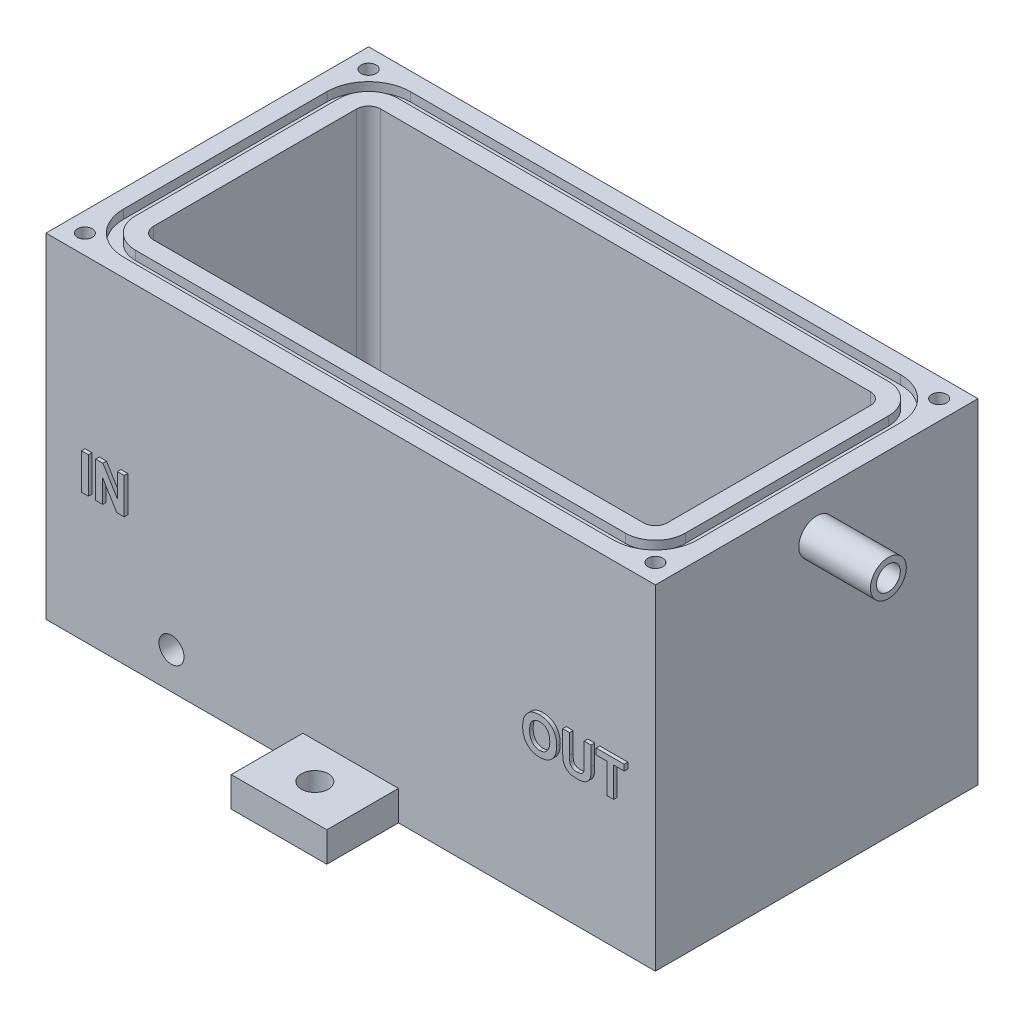
from build123d import *

# Parameters (mm, degrees)
SKETCH1_W                = 102
SKETCH1_H                = 54
BODY_DEPTH               = 56
CHAMBER_START            = 56
CHAMBER_DEPTH            = 52
FLOOR_FILLET_R           = 2
GASKET_GROOVE_START      = 56
GASKET_GROOVE_DEPTH      = 1.5
CAP_SCREW_HOLES_M3_START = 56
SKETCH4_R                = 1.25
CAP_SCREW_HOLES_M3_DEPTH = 12
INLET_BARB_START         = -63
SKETCH5_R                = 3
INLET_BARB_DEPTH         = 12
OUTLET_BARB_START        = 51
SKETCH6_R                = 3
OUTLET_BARB_DEPTH        = 12
INLET_BORE_START         = -63
SKETCH7_R                = 2
INLET_BORE_DEPTH         = 20.5
OUTLET_BORE_START        = 42.5
SKETCH8_R                = 2
OUTLET_BORE_DEPTH        = 20.5
DRAIN_HOLE_M5_START      = 18.5
SKETCH9_R                = 2.1
DRAIN_HOLE_M5_DEPTH      = 9
SKETCH10_W               = 16
SKETCH10_H               = 12
FOOT_FRONT_DEPTH         = 5
SKETCH11_W               = 16
SKETCH11_H               = 12
FOOT_BACK_DEPTH          = 5
FOOT_HOLES_M4_START      = -0.5
SKETCH12_R               = 2.25
FOOT_HOLES_M4_DEPTH      = 6
LABEL_IN_START           = 27
SKETCH13_W               = 1.153846154
SKETCH13_H               = 6
LABEL_IN_DEPTH           = 0.6
LABEL_OUT_START          = 27
LABEL_OUT_DEPTH          = 0.6


with BuildPart() as part:
    # Sketch1 → Body (new body)
    with BuildSketch(Plane(origin=(0, 0, 0), x_dir=(1, 0, 0), z_dir=(0, 1, 0))):
        Rectangle(SKETCH1_W, SKETCH1_H)
    extrude(amount=BODY_DEPTH)

    # Sketch2 → Chamber (cut)
    with BuildSketch(Plane(origin=(0, 0, 0), x_dir=(1, 0, 0), z_dir=(0, 1, 0)).offset(CHAMBER_START)):
        with BuildLine():
            Line((-41, -19), (41, -19))
            ThreePointArc((41, -19), (42.414213562, -18.414213562), (43, -17))
            Line((43, -17), (43, 17))
            ThreePointArc((43, 17), (42.414213562, 18.414213562), (41, 19))
            Line((41, 19), (-41, 19))
            ThreePointArc((-41, 19), (-42.414213562, 18.414213562), (-43, 17))
            Line((-43, 17), (-43, -17))
            ThreePointArc((-43, -17), (-42.414213562, -18.414213562), (-41, -19))
        make_face()
    extrude(amount=-CHAMBER_DEPTH, mode=Mode.SUBTRACT)

    # Floor_Fillet
    floor_fillet_edges = [part.edges().sort_by_distance(p)[0] for p in [
        (-43, 4, 0),
        (-42.414213562, 4, -18.414213562),
        (0, 4, -19),
        (42.414213562, 4, -18.414213562),
        (43, 4, 0),
        (42.414213562, 4, 18.414213562),
        (0, 4, 19),
        (-42.414213562, 4, 18.414213562),
    ]]
    fillet(floor_fillet_edges, radius=FLOOR_FILLET_R)

    # Sketch3 → Gasket_Groove (cut)
    with BuildSketch(Plane(origin=(0, 0, 0), x_dir=(1, 0, 0), z_dir=(0, 1, 0)).offset(GASKET_GROOVE_START)):
        with BuildLine():
            Line((-41, -24), (41, -24))
            ThreePointArc((41, -24), (45.949747468, -21.949747468), (48, -17))
            Line((48, -17), (48, 17))
            ThreePointArc((48, 17), (45.949747468, 21.949747468), (41, 24))
            Line((41, 24), (-41, 24))
            ThreePointArc((-41, 24), (-45.949747468, 21.949747468), (-48, 17))
            Line((-48, 17), (-48, -17))
            ThreePointArc((-48, -17), (-45.949747468, -21.949747468), (-41, -24))
        make_face()
        with BuildLine():
            Line((-41, -22), (41, -22))
            ThreePointArc((41, -22), (44.535533906, -20.535533906), (46, -17))
            Line((46, -17), (46, 17))
            ThreePointArc((46, 17), (44.535533906, 20.535533906), (41, 22))
            Line((41, 22), (-41, 22))
            ThreePointArc((-41, 22), (-44.535533906, 20.535533906), (-46, 17))
            Line((-46, 17), (-46, -17))
            ThreePointArc((-46, -17), (-44.535533906, -20.535533906), (-41, -22))
        make_face(mode=Mode.SUBTRACT)
    extrude(amount=-GASKET_GROOVE_DEPTH, mode=Mode.SUBTRACT)

    # Sketch4 → Cap_Screw_Holes_M3 (cut)
    with BuildSketch(Plane(origin=(0, 0, 0), x_dir=(1, 0, 0), z_dir=(0, 1, 0)).offset(CAP_SCREW_HOLES_M3_START)):
        with Locations((-47.75, 23.75)):
            Circle(SKETCH4_R)
        with Locations((-47.75, -23.75)):
            Circle(SKETCH4_R)
        with Locations((47.75, 23.75)):
            Circle(SKETCH4_R)
        with Locations((47.75, -23.75)):
            Circle(SKETCH4_R)
    extrude(amount=-CAP_SCREW_HOLES_M3_DEPTH, mode=Mode.SUBTRACT)

    # Sketch5 → Inlet_Barb (add)
    with BuildSketch(Plane(origin=(0, 0, 0), x_dir=(0, 0, -1), z_dir=(1, 0, 0)).offset(INLET_BARB_START)):
        with Locations((0, 10)):
            Circle(SKETCH5_R)
    extrude(amount=INLET_BARB_DEPTH)

    # Sketch6 → Outlet_Barb (add)
    with BuildSketch(Plane(origin=(0, 0, 0), x_dir=(0, 0, -1), z_dir=(1, 0, 0)).offset(OUTLET_BARB_START)):
        with Locations((0, 49.5)):
            Circle(SKETCH6_R)
    extrude(amount=OUTLET_BARB_DEPTH)

    # Sketch7 → Inlet_Bore (cut)
    with BuildSketch(Plane(origin=(0, 0, 0), x_dir=(0, 0, -1), z_dir=(1, 0, 0)).offset(INLET_BORE_START)):
        with Locations((0, 10)):
            Circle(SKETCH7_R)
    extrude(amount=INLET_BORE_DEPTH, mode=Mode.SUBTRACT)

    # Sketch8 → Outlet_Bore (cut)
    with BuildSketch(Plane(origin=(0, 0, 0), x_dir=(0, 0, -1), z_dir=(1, 0, 0)).offset(OUTLET_BORE_START)):
        with Locations((0, 49.5)):
            Circle(SKETCH8_R)
    extrude(amount=OUTLET_BORE_DEPTH, mode=Mode.SUBTRACT)

    # Sketch9 → Drain_Hole_M5 (cut)
    with BuildSketch(Plane.XY.offset(DRAIN_HOLE_M5_START)):
        with Locations((-30, 6.1)):
            Circle(SKETCH9_R)
    extrude(amount=DRAIN_HOLE_M5_DEPTH, mode=Mode.SUBTRACT)

    # Sketch10 → Foot_Front (add)
    with BuildSketch(Plane(origin=(0, 0, 0), x_dir=(1, 0, 0), z_dir=(0, 1, 0))):
        with Locations((0, -33)):
            Rectangle(SKETCH10_W, SKETCH10_H)
    extrude(amount=FOOT_FRONT_DEPTH)

    # Sketch11 → Foot_Back (add)
    with BuildSketch(Plane(origin=(0, 0, 0), x_dir=(1, 0, 0), z_dir=(0, 1, 0))):
        with Locations((0, 33)):
            Rectangle(SKETCH11_W, SKETCH11_H)
    extrude(amount=FOOT_BACK_DEPTH)

    # Sketch12 → Foot_Holes_M4 (cut)
    with BuildSketch(Plane(origin=(0, 0, 0), x_dir=(1, 0, 0), z_dir=(0, 1, 0)).offset(FOOT_HOLES_M4_START)):
        with Locations((0, 33)):
            Circle(SKETCH12_R)
        with Locations((0, -33)):
            Circle(SKETCH12_R)
    extrude(amount=FOOT_HOLES_M4_DEPTH, mode=Mode.SUBTRACT)

    # Sketch13 → Label_IN (add)
    with BuildSketch(Plane.XY.offset(LABEL_IN_START)):
        with Locations((-43.884615385, 25)):
            Rectangle(SKETCH13_W, SKETCH13_H)
        Polygon((-42.076923077, 22), (-42.076923077, 28), (-40.871394231, 28), (-38.461538462, 24.055288462), (-38.461538462, 28), (-37.307692308, 28), (-37.307692308, 22), (-38.550480769, 22), (-40.923076923, 25.882211538), (-40.923076923, 22), align=None)
    extrude(amount=LABEL_IN_DEPTH)

    # Sketch14 → Label_OUT (add)
    # profile 1 of 3: a face of its own
    with BuildSketch(Plane.XY.offset(LABEL_OUT_START)):
        with BuildLine():
            add(Edge.make_bspline(
                [(29.384615385, 24.963942308), (29.38503998, 25.038087831), (29.385873831, 25.183700069), (29.400322529, 25.397318689), (29.419367039, 25.602080111), (29.450380992, 25.797178935), (29.486864724, 25.98352829), (29.53249619, 26.16107286), (29.587465947, 26.329190002), (29.631194825, 26.436530981), (29.652644231, 26.489182692)],
                knots=[0, 0, 0, 0, 1.141009212, 2.240794809, 3.294380675, 4.305229195, 5.280013876, 6.216333343, 7.125095522, 8, 8, 8, 8], degree=3))
            add(Edge.make_bspline(
                [(29.652644231, 26.489182692), (29.68770587, 26.564033199), (29.757416765, 26.712853848), (29.886880854, 26.92314939), (30.033620766, 27.121475125), (30.196428431, 27.306791347), (30.371147317, 27.476308227), (30.558601668, 27.621390267), (30.752131794, 27.746937197), (30.889775649, 27.810079841), (30.957932692, 27.841346154)],
                knots=[0, 0, 0, 0, 1.031372299, 2.050613973, 3.077158538, 4.108712802, 5.127684358, 6.111366908, 7.06480644, 8, 8, 8, 8], degree=3))
            add(Edge.make_bspline(
                [(30.957932692, 27.841346154), (31.004197438, 27.86032292), (31.097710285, 27.898679804), (31.243040257, 27.946551204), (31.393884459, 27.985444553), (31.549151844, 28.020210675), (31.71034993, 28.04418306), (31.876176168, 28.064283081), (32.04753807, 28.074817852), (32.163449433, 28.076213703), (32.222355769, 28.076923077)],
                knots=[0, 0, 0, 0, 0.92659354, 1.872881803, 2.832850937, 3.813025581, 4.820167273, 5.851730198, 6.908245912, 8, 8, 8, 8], degree=3))
            add(Edge.make_bspline(
                [(32.222355769, 28.076923077), (32.327832127, 28.074279131), (32.534250808, 28.069104892), (32.835770536, 28.031731983), (33.121099748, 27.968624384), (33.389272598, 27.877410513), (33.642601191, 27.763391194), (33.879117314, 27.621963213), (34.099171016, 27.454657253), (34.302337274, 27.263767616), (34.485303041, 27.049626974), (34.644651025, 26.814235721), (34.778322439, 26.558696922), (34.888408567, 26.283715619), (34.973001461, 25.988393638), (35.034119749, 25.673564258), (35.070428959, 25.338995583), (35.074719544, 25.109466651), (35.076923077, 24.991586538)],
                knots=[0, 0, 0, 0, 1.064641025, 2.083517118, 3.061799897, 4.009540929, 4.938075217, 5.861300345, 6.78508344, 7.723570974, 8.670267188, 9.622657076, 10.586935816, 11.576069104, 12.607749008, 13.683335114, 14.81022093, 16, 16, 16, 16], degree=3))
            add(Edge.make_bspline(
                [(35.076923077, 24.991586538), (35.074770439, 24.874495767), (35.070579654, 24.646541912), (35.03359271, 24.314598611), (34.975008297, 24.002064346), (34.888368592, 23.70965306), (34.781568073, 23.435133459), (34.646521146, 23.18177529), (34.49051039, 22.946217925), (34.307804492, 22.734384816), (34.108057637, 22.542399663), (33.888283062, 22.377049089), (33.65348866, 22.23542948), (33.401541263, 22.121080663), (33.134083015, 22.031745309), (32.850241086, 21.968152775), (32.549869901, 21.930923681), (32.344255492, 21.925730656), (32.239182692, 21.923076923)],
                knots=[0, 0, 0, 0, 1.18845052, 2.313691126, 3.386664782, 4.412527756, 5.405809582, 6.372003093, 7.321919452, 8.268293321, 9.206237639, 10.129603466, 11.054616372, 11.9847576, 12.932764752, 13.912672021, 14.933336461, 16, 16, 16, 16], degree=3))
            add(Edge.make_bspline(
                [(32.239182692, 21.923076923), (32.132909686, 21.92573678), (31.924902882, 21.930942883), (31.621327958, 21.968058654), (31.334668415, 22.031672122), (31.065128381, 22.121321714), (30.810869543, 22.233933433), (30.574239375, 22.374105894), (30.355107073, 22.540503663), (30.153691216, 22.730228983), (29.971098292, 22.941439299), (29.815309051, 23.175482096), (29.680255081, 23.426365589), (29.572893057, 23.69789006), (29.486730446, 23.987261872), (29.428002877, 24.296146094), (29.390944413, 24.623692593), (29.386763621, 24.848452704), (29.384615385, 24.963942308)],
                knots=[0, 0, 0, 0, 1.080878253, 2.11558926, 3.1052859, 4.062802436, 5.000434901, 5.928596448, 6.853693179, 7.793554778, 8.738606028, 9.68692032, 10.647726704, 11.63151566, 12.651483354, 13.714466703, 14.825613081, 16, 16, 16, 16], degree=3))
        make_face()
        with BuildLine():
            add(Edge.make_bspline(
                [(30.538461538, 25.003605769), (30.539614216, 24.920609918), (30.541846355, 24.75989003), (30.565621589, 24.526609004), (30.601702418, 24.308523961), (30.654764578, 24.105882422), (30.721798516, 23.918537791), (30.803928988, 23.746333357), (30.90081658, 23.589012639), (31.014967294, 23.449896898), (31.138469416, 23.325693357), (31.271778939, 23.21822597), (31.412411442, 23.125728134), (31.562800295, 23.052701406), (31.719815635, 22.994746707), (31.884677364, 22.951775421), (32.058205212, 22.928179964), (32.176615799, 22.924796183), (32.236778846, 22.923076923)],
                knots=[0, 0, 0, 0, 1.313550922, 2.543666373, 3.708465049, 4.810029406, 5.85539231, 6.85404609, 7.825601258, 8.772642133, 9.696587791, 10.59409323, 11.479048685, 12.35559886, 13.234601248, 14.125357077, 15.047515647, 16, 16, 16, 16], degree=3))
            add(Edge.make_bspline(
                [(32.236778846, 22.923076923), (32.296949999, 22.924761348), (32.415376537, 22.928076569), (32.588691172, 22.952154466), (32.753879613, 22.993283912), (32.910271178, 23.050941627), (33.058578679, 23.125127931), (33.198672938, 23.215552159), (33.329746418, 23.323508476), (33.45311411, 23.44590765), (33.564183622, 23.585947383), (33.660246295, 23.743240952), (33.742336301, 23.916489811), (33.809377299, 24.105758772), (33.861133588, 24.311403942), (33.895741871, 24.533534128), (33.919709361, 24.771514191), (33.921932396, 24.935833245), (33.923076923, 25.020432692)],
                knots=[0, 0, 0, 0, 0.949153107, 1.868086493, 2.754172764, 3.630100905, 4.492260106, 5.365378617, 6.254840125, 7.166615376, 8.102436631, 9.067266169, 10.06813181, 11.121736829, 12.23011542, 13.408501285, 14.665770308, 16, 16, 16, 16], degree=3))
            add(Edge.make_bspline(
                [(33.923076923, 25.020432692), (33.921784166, 25.104215287), (33.919280618, 25.266468243), (33.897477305, 25.501444033), (33.861767506, 25.720052964), (33.812126941, 25.922238406), (33.746523814, 26.108032938), (33.668168557, 26.277944634), (33.573425922, 26.431085799), (33.464767729, 26.567377139), (33.344532434, 26.687339795), (33.214762796, 26.792361961), (33.074721508, 26.879746788), (32.925775352, 26.953269264), (32.766373642, 27.007815321), (32.598136272, 27.047600755), (32.420587144, 27.072100686), (32.298957118, 27.075291769), (32.236778846, 27.076923077)],
                knots=[0, 0, 0, 0, 1.332337092, 2.580197383, 3.749299508, 4.852775005, 5.886662144, 6.878700295, 7.822989687, 8.743523536, 9.644687758, 10.519443927, 11.392806431, 12.264866173, 13.155606721, 14.065961015, 15.011303331, 16, 16, 16, 16], degree=3))
            add(Edge.make_bspline(
                [(32.236778846, 27.076923077), (32.174592715, 27.075316862), (32.052947316, 27.072174864), (31.875121429, 27.047269302), (31.706354058, 27.008669372), (31.546974878, 26.951008729), (31.396731353, 26.878192302), (31.256179193, 26.787885418), (31.124210891, 26.683041483), (31.002898323, 26.561259918), (30.892479525, 26.423775092), (30.797691265, 26.268762698), (30.716863448, 26.097915665), (30.65054891, 25.910728268), (30.601389331, 25.706685568), (30.563606103, 25.487158855), (30.542388443, 25.250819425), (30.53979864, 25.087781416), (30.538461538, 25.003605769)],
                knots=[0, 0, 0, 0, 0.981996942, 1.920933313, 2.83127778, 3.712125466, 4.592427284, 5.463259035, 6.34592384, 7.249932058, 8.173122297, 9.125107726, 10.113123258, 11.154048744, 12.256187849, 13.424658091, 14.670364834, 16, 16, 16, 16], degree=3))
        make_face(mode=Mode.SUBTRACT)
    # profile 2 of 3: a face of its own
    with BuildSketch(Plane.XY.offset(LABEL_OUT_START)):
        with BuildLine():
            Line((36.076923077, 28), (37.230769231, 28))
            Line((37.230769231, 28), (37.230769231, 24.743990385))
            add(Edge.make_bspline(
                [(37.230769231, 24.743990385), (37.231209727, 24.682291735), (37.232050675, 24.564503156), (37.232629547, 24.396219553), (37.235833094, 24.245126906), (37.2427803, 24.110981752), (37.24754836, 23.993852503), (37.256402128, 23.89371766), (37.265234439, 23.810616221), (37.273821567, 23.761186798), (37.277644231, 23.739182692)],
                knots=[0, 0, 0, 0, 1.470600056, 2.807515117, 4.011048972, 5.072079398, 6.00911328, 6.804506435, 7.467811572, 8, 8, 8, 8], degree=3))
            add(Edge.make_bspline(
                [(37.277644231, 23.739182692), (37.293404126, 23.679862839), (37.324437349, 23.563054558), (37.409976324, 23.403380739), (37.522972103, 23.262638322), (37.638231963, 23.162266324), (37.742493385, 23.091230471), (37.83105492, 23.047997027), (37.925018131, 23.008586963), (38.026369449, 22.978347954), (38.13402111, 22.951887734), (38.249273434, 22.936588249), (38.371153759, 22.924846275), (38.45469496, 22.923677254), (38.497596154, 22.923076923)],
                knots=[0, 0, 0, 0, 1.376921055, 2.711331395, 4.038631339, 5.418057255, 6.132954575, 6.870556231, 7.630397752, 8.422890386, 9.247036838, 10.121396817, 11.035274583, 12, 12, 12, 12], degree=3))
            add(Edge.make_bspline(
                [(38.497596154, 22.923076923), (38.540878768, 22.923861934), (38.625149135, 22.925390335), (38.747271282, 22.934492496), (38.861209158, 22.951665136), (38.966893062, 22.974181784), (39.064881179, 23.002639053), (39.154391776, 23.0386693), (39.235283797, 23.082028437), (39.330330701, 23.147381369), (39.432601046, 23.239573089), (39.531023195, 23.36491951), (39.601463158, 23.503288323), (39.634502486, 23.629629399), (39.651483591, 23.739706499), (39.661829394, 23.836027783), (39.671291153, 23.945030056), (39.679883154, 24.066414761), (39.685758981, 24.200273012), (39.688937113, 24.346943345), (39.691438319, 24.50640237), (39.692010993, 24.616986099), (39.692307692, 24.674278846)],
                knots=[0, 0, 0, 0, 1.036876239, 2.018776863, 2.930845756, 3.794842666, 4.605604932, 5.371924355, 6.101864688, 6.799283669, 8.1310906, 9.382718023, 10.597336334, 11.822035891, 12.492591141, 13.265194674, 14.141890321, 15.11351293, 16.179860579, 17.351049011, 18.627594861, 20, 20, 20, 20], degree=3))
            Line((39.692307692, 24.674278846), (39.692307692, 28))
            Line((39.692307692, 28), (40.846153846, 28))
            Line((40.846153846, 28), (40.846153846, 24.861778846))
            add(Edge.make_bspline(
                [(40.846153846, 24.861778846), (40.846005955, 24.775239518), (40.845721787, 24.608956579), (40.841284896, 24.369716915), (40.831855095, 24.150224553), (40.82395845, 23.95010325), (40.808726147, 23.769863537), (40.792777978, 23.609393346), (40.772233105, 23.468720723), (40.742935924, 23.308825844), (40.693700107, 23.129434078), (40.614348898, 22.931272866), (40.512935667, 22.750988581), (40.389864527, 22.587889491), (40.245844466, 22.441327354), (40.078719088, 22.311878354), (39.890206936, 22.197968758), (39.717457319, 22.115946731), (39.566841786, 22.060715785), (39.444167954, 22.023337956), (39.312878824, 21.992210045), (39.173128376, 21.967507278), (39.024856562, 21.946679192), (38.868009545, 21.932769443), (38.702824621, 21.924088778), (38.590155733, 21.92341963), (38.532451923, 21.923076923)],
                knots=[0, 0, 0, 0, 1.415574045, 2.719986624, 3.913607924, 5.00929969, 5.995467356, 6.871900228, 7.64671288, 8.320227872, 9.530145585, 10.682614022, 11.803571353, 12.90325401, 14.015460715, 15.154679255, 16.351678057, 17.612271512, 18.275764165, 18.974412946, 19.708786676, 20.481351116, 21.295095879, 22.157200529, 23.056203067, 24, 24, 24, 24], degree=3))
            add(Edge.make_bspline(
                [(38.532451923, 21.923076923), (38.463136169, 21.923962959), (38.328861219, 21.925679341), (38.133949967, 21.933335978), (37.95234228, 21.949139567), (37.783467582, 21.970499599), (37.627395596, 21.997958618), (37.483731499, 22.030785703), (37.353622237, 22.072274507), (37.198651665, 22.13153055), (37.025911112, 22.222172431), (36.837875711, 22.343087962), (36.672812965, 22.479562608), (36.532173198, 22.63026284), (36.414603828, 22.78989271), (36.319040702, 22.954998003), (36.242459558, 23.12282679), (36.210459609, 23.239471081), (36.194711538, 23.296875)],
                knots=[0, 0, 0, 0, 1.128613534, 2.186292659, 3.174878439, 4.095586888, 4.95671962, 5.754129884, 6.492676435, 7.178284149, 8.453103036, 9.659838108, 10.813193309, 11.929983019, 13.007587775, 14.033493319, 15.032227051, 16, 16, 16, 16], degree=3))
            add(Edge.make_bspline(
                [(36.194711538, 23.296875), (36.185073165, 23.342068471), (36.164771668, 23.437260374), (36.141714802, 23.588596838), (36.120680147, 23.755243631), (36.106313203, 23.937397869), (36.092694656, 24.134481608), (36.082917021, 24.346866452), (36.078896449, 24.574504174), (36.077594119, 24.731569859), (36.076923077, 24.8125)],
                knots=[0, 0, 0, 0, 0.728071598, 1.533551606, 2.411422299, 3.374601532, 4.412367648, 5.524718474, 6.72457895, 8, 8, 8, 8], degree=3))
            Line((36.076923077, 24.8125), (36.076923077, 28))
        make_face()
    # profile 3 of 3: a face of its own
    with BuildSketch(Plane.XY.offset(LABEL_OUT_START)):
        Polygon((43.461538462, 22), (43.461538462, 27), (41.692307692, 27), (41.692307692, 28), (46.384615385, 28), (46.384615385, 27), (44.615384615, 27), (44.615384615, 22), align=None)
    extrude(amount=LABEL_OUT_DEPTH)


solid = part.part
